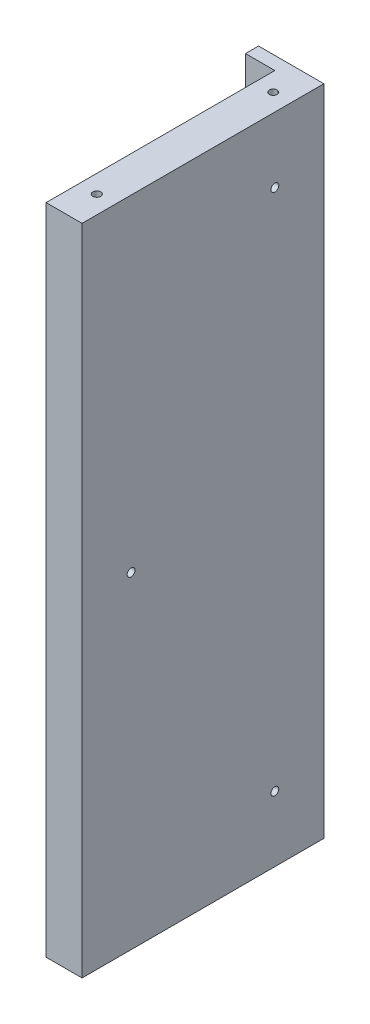
from build123d import *

# Parameters (mm, degrees)
SKETCH1_W                = 20
SKETCH1_H                = 100
BOSS_EXTRUDE1_DEPTH      = 200
SKETCH2_W                = 9
SKETCH2_H                = 70
CUT_EXTRUDE1_DEPTH       = 207.397674406
M2_CLEARANCE_HOLE1_D     = 2.4
M2_CLEARANCE_HOLE1_DEPTH = 4
M2_CLEARANCE_HOLE1_TIP   = 0.721032743
M2_CLEARANCE_HOLE2_D     = 2.4
M2_CLEARANCE_HOLE2_DEPTH = 4
M2_CLEARANCE_HOLE2_TIP   = 0.721032743
M2_CLEARANCE_HOLE4_D     = 2.4
SKETCH13_W               = 20
SKETCH13_H               = 26
CUT_EXTRUDE2_DEPTH       = 207.397674406
M2_CLEARANCE_HOLE5_D     = 2.4
M2_CLEARANCE_HOLE5_DEPTH = 11
M2_CLEARANCE_HOLE5_TIP   = 0.721032743
M2_CLEARANCE_HOLE6_D     = 2.4
M2_CLEARANCE_HOLE6_DEPTH = 11
M2_CLEARANCE_HOLE6_TIP   = 0.721032743
M2_CLEARANCE_HOLE7_D     = 2.4
M2_CLEARANCE_HOLE7_DEPTH = 11
M2_CLEARANCE_HOLE7_TIP   = 0.721032743


with BuildPart() as part:
    # Sketch1 → Boss-Extrude1 (new body)
    with BuildSketch(Plane(origin=(0, 0, 0), x_dir=(1, 0, 0), z_dir=(0, 1, 0))):
        Rectangle(SKETCH1_W, SKETCH1_H)
    extrude(amount=BOSS_EXTRUDE1_DEPTH)

    # Sketch2 → Cut-Extrude1 (cut, through all)
    with BuildSketch(Plane(origin=(0, 200, 0), x_dir=(1, 0, 0), z_dir=(0, 1, 0))):
        with Locations((-5.5, -15)):
            Rectangle(SKETCH2_W, SKETCH2_H)
    extrude(amount=-CUT_EXTRUDE1_DEPTH, mode=Mode.SUBTRACT)

    # M2 Clearance Hole1
    with Locations(Plane(origin=(0, 200, 0), x_dir=(1, 0, 0), z_dir=(0, 1, 0))):
        with Locations((4.5, 40), (4.5, -40)):
            Hole(M2_CLEARANCE_HOLE1_D / 2, depth=M2_CLEARANCE_HOLE1_DEPTH)
            with Locations((0, 0, -(M2_CLEARANCE_HOLE1_DEPTH + M2_CLEARANCE_HOLE1_TIP / 2))):  # 118° drill point
                Cone(0, M2_CLEARANCE_HOLE1_D / 2, M2_CLEARANCE_HOLE1_TIP, mode=Mode.SUBTRACT)

    # M2 Clearance Hole2
    with Locations(Plane(origin=(0, 0, 0), x_dir=(-1, 0, 0), z_dir=(0, -1, 0))):
        with Locations((-4.5, 40), (-4.5, -40)):
            Hole(M2_CLEARANCE_HOLE2_D / 2, depth=M2_CLEARANCE_HOLE2_DEPTH)
            with Locations((0, 0, -(M2_CLEARANCE_HOLE2_DEPTH + M2_CLEARANCE_HOLE2_TIP / 2))):  # 118° drill point
                Cone(0, M2_CLEARANCE_HOLE2_D / 2, M2_CLEARANCE_HOLE2_TIP, mode=Mode.SUBTRACT)

    # M2 Clearance Hole4 (through all)
    with Locations(Plane(origin=(0, 0, -50), x_dir=(-1, 0, 0), z_dir=(0, 0, -1))):
        with Locations((5, 190), (5, 10)):
            Hole(M2_CLEARANCE_HOLE4_D / 2)

    # Sketch13 → Cut-Extrude2 (cut, through all)
    with BuildSketch(Plane.XZ):
        with Locations((0, -37)):
            Rectangle(SKETCH13_W, SKETCH13_H)
    extrude(amount=-CUT_EXTRUDE2_DEPTH, mode=Mode.SUBTRACT)

    # M2 Clearance Hole5
    with Locations(Plane(origin=(0, 0, 0), x_dir=(-1, 0, 0), z_dir=(0, -1, 0))):
        with Locations((-4.5, 14)):
            Hole(M2_CLEARANCE_HOLE5_D / 2, depth=M2_CLEARANCE_HOLE5_DEPTH)
            with Locations((0, 0, -(M2_CLEARANCE_HOLE5_DEPTH + M2_CLEARANCE_HOLE5_TIP / 2))):  # 118° drill point
                Cone(0, M2_CLEARANCE_HOLE5_D / 2, M2_CLEARANCE_HOLE5_TIP, mode=Mode.SUBTRACT)

    # M2 Clearance Hole6
    with Locations(Plane(origin=(0, 200, 0), x_dir=(1, 0, 0), z_dir=(0, 1, 0))):
        with Locations((4.5, 14)):
            Hole(M2_CLEARANCE_HOLE6_D / 2, depth=M2_CLEARANCE_HOLE6_DEPTH)
            with Locations((0, 0, -(M2_CLEARANCE_HOLE6_DEPTH + M2_CLEARANCE_HOLE6_TIP / 2))):  # 118° drill point
                Cone(0, M2_CLEARANCE_HOLE6_D / 2, M2_CLEARANCE_HOLE6_TIP, mode=Mode.SUBTRACT)

    # M2 Clearance Hole7
    with Locations(Plane(origin=(10, 0, 0), x_dir=(0, 0, -1), z_dir=(1, 0, 0))):
        with Locations((9, 20), (9, 180), (-35, 100)):
            Hole(M2_CLEARANCE_HOLE7_D / 2, depth=M2_CLEARANCE_HOLE7_DEPTH)
            with Locations((0, 0, -(M2_CLEARANCE_HOLE7_DEPTH + M2_CLEARANCE_HOLE7_TIP / 2))):  # 118° drill point
                Cone(0, M2_CLEARANCE_HOLE7_D / 2, M2_CLEARANCE_HOLE7_TIP, mode=Mode.SUBTRACT)


solid = part.part
